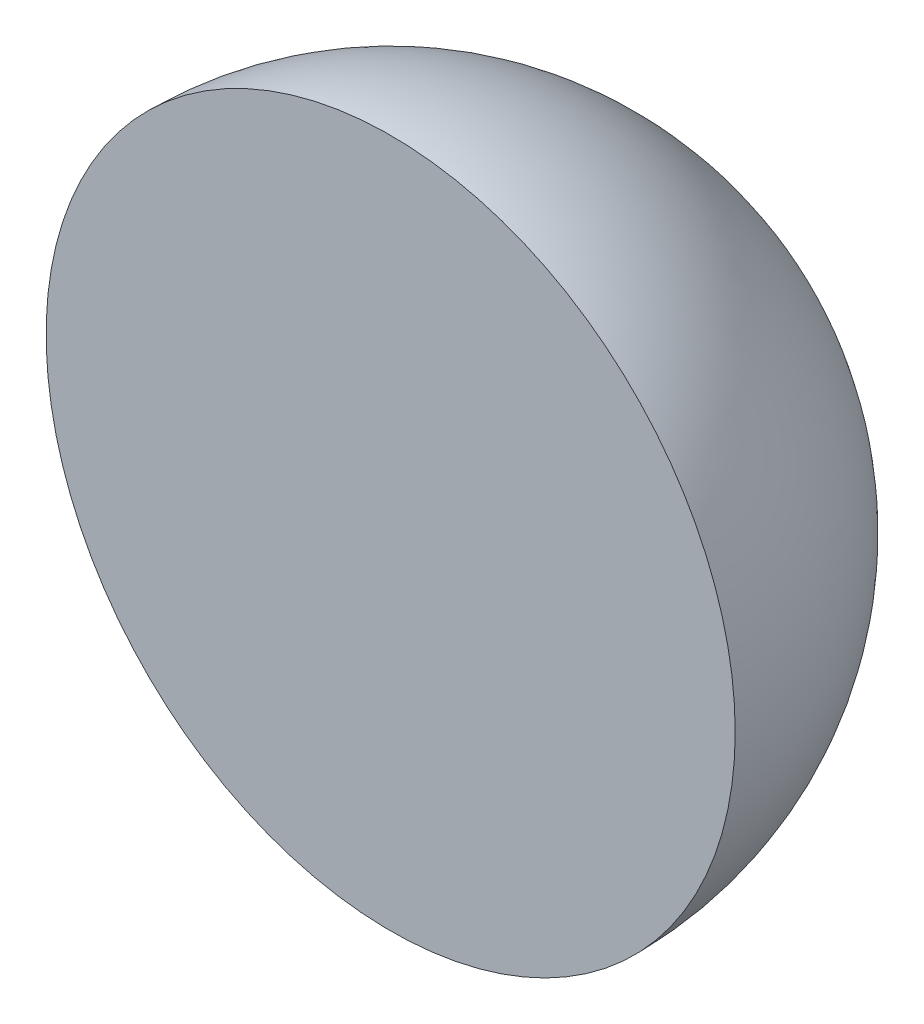
from build123d import *

# Parameters (mm, degrees)
REVOLVE1_ANGLE = 180


with BuildPart() as part:
    # Sketch1 → Revolve1 (revolve)
    with BuildSketch(Plane.XY.offset(1.5)):
        with BuildLine():
            Line((0, 1.5), (0, -1.5))
            ThreePointArc((0, -1.5), (1.060660172, -1.060660172), (1.5, 0))
            ThreePointArc((1.5, 0), (1.060660172, 1.060660172), (0, 1.5))
        make_face()
    revolve(axis=Axis((0, 1.5, 1.5), (0, 1, 0)), revolution_arc=REVOLVE1_ANGLE)


solid = part.part
